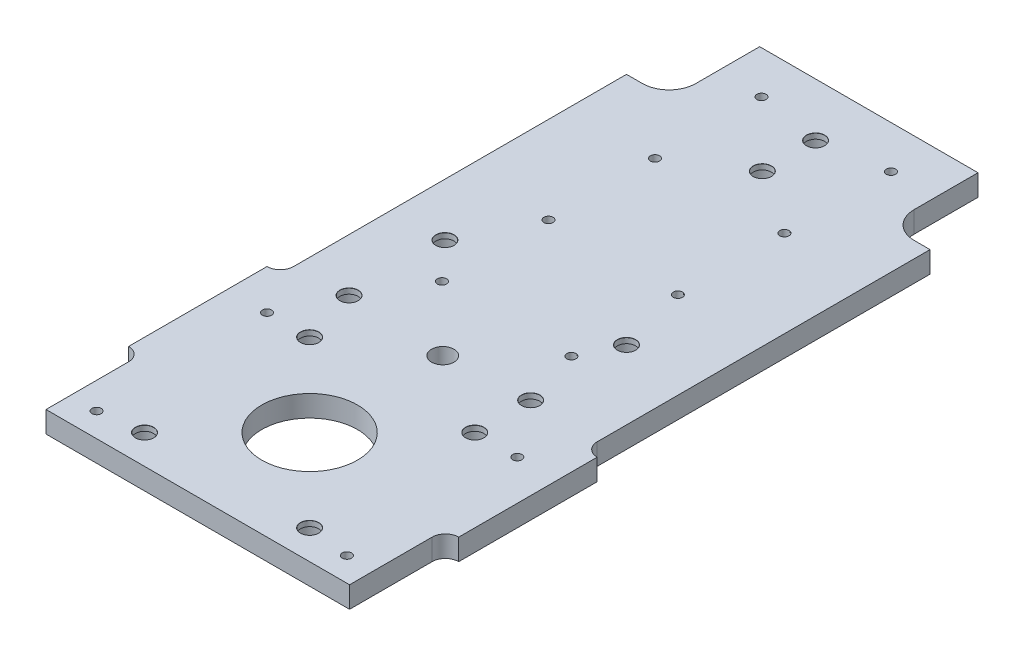
from build123d import *

# Parameters (mm, degrees)
PLATE_MAIN_SKETCH_R            = 0.86491532
PLATE_MAIN_SKETCH_R_2          = 8.982669203
PLATE_MAIN_SKETCH_R_3          = 2.111650326
EXTRUDE_PLATE_MAIN_DEPTH       = 4
CBORE_FOR_M3_SHCS1_AT_2_COUNT  = 2
CBORE_FOR_M3_SHCS1_AT_2_PITCH  = 31
CBORE_FOR_M3_SHCS1_AT_3_COUNT  = 2
CBORE_FOR_M3_SHCS1_AT_3_PITCH  = 43.840620434
CBORE_FOR_M3_SHCS1_AT_4_COUNT  = 2
CBORE_FOR_M3_SHCS1_AT_4_PITCH  = 31
CBORE_FOR_M3_SHCS1_AT_5_COUNT  = 2
CBORE_FOR_M3_SHCS1_AT_5_PITCH  = 41.615227408
CBORE_FOR_M3_SHCS1_AT_6_COUNT  = 2
CBORE_FOR_M3_SHCS1_AT_6_PITCH  = 51.800096525
CBORE_FOR_M3_SHCS1_AT_7_COUNT  = 2
CBORE_FOR_M3_SHCS1_AT_7_PITCH  = 67.091355628
CBORE_FOR_M3_SHCS1_AT_8_COUNT  = 2
CBORE_FOR_M3_SHCS1_AT_8_PITCH  = 59.580425915
CBORE_FOR_M3_SHCS1_AT_9_COUNT  = 2
CBORE_FOR_M3_SHCS1_AT_9_PITCH  = 101.688249075
CBORE_FOR_M3_SHCS1_AT_10_COUNT = 2
CBORE_FOR_M3_SHCS1_AT_10_PITCH = 111.581808553


with BuildPart() as part:
    # Plate Main Sketch → Extrude Plate Main (new body)
    with BuildSketch(Plane(origin=(-158.085545862, 0, 24.679095537), x_dir=(-1, 0, 0), z_dir=(0, 1, 0))):
        with BuildLine():
            Line((-178.585545862, -24.679095537), (-137.585545862, -24.679095537))
            Line((-137.585545862, -24.679095537), (-137.585545862, -12.679095537))
            ThreePointArc((-137.585545862, -12.679095537), (-136.121079768, -9.143561631), (-132.585545862, -7.679095537))
            Line((-132.585545862, -7.679095537), (-129.585545862, -7.679095537))
            Line((-129.585545862, -7.679095537), (-129.585545862, 54.820904463))
            ThreePointArc((-129.585545862, 54.820904463), (-128.853312815, 56.588671416), (-127.085545862, 57.320904463))
            Line((-127.085545862, 57.320904463), (-127.085545862, 83.320904463))
            ThreePointArc((-127.085545862, 83.320904463), (-128.853312815, 84.05313751), (-129.585545862, 85.820904463))
            Line((-129.585545862, 85.820904463), (-129.585545862, 101.320904463))
            Line((-129.585545862, 101.320904463), (-186.585545862, 101.320904463))
            Line((-186.585545862, 101.320904463), (-186.585545862, 85.820904463))
            ThreePointArc((-186.585545862, 85.820904463), (-187.317778909, 84.05313751), (-189.085545862, 83.320904463))
            Line((-189.085545862, 83.320904463), (-189.085545862, 57.320904463))
            ThreePointArc((-189.085545862, 57.320904463), (-187.317778909, 56.588671416), (-186.585545862, 54.820904463))
            Line((-186.585545862, 54.820904463), (-186.585545862, -7.679095537))
            Line((-186.585545862, -7.679095537), (-183.585545862, -7.679095537))
            ThreePointArc((-183.585545862, -7.679095537), (-180.050011956, -9.143561631), (-178.585545862, -12.679095537))
            Line((-178.585545862, -12.679095537), (-178.585545862, -24.679095537))
        make_face()
        with Locations(Location((-134.585545862, 96.820904463, 0), (0, 0, 90))):
            Circle(PLATE_MAIN_SKETCH_R, mode=Mode.SUBTRACT)
        with Locations(Location((-134.585545862, 64.820904463, 0), (0, 0, 90))):
            Circle(PLATE_MAIN_SKETCH_R, mode=Mode.SUBTRACT)
        with Locations(Location((-181.585545862, 64.820904463, 0), (0, 0, 90))):
            Circle(PLATE_MAIN_SKETCH_R, mode=Mode.SUBTRACT)
        with Locations(Location((-181.585545862, 96.820904463, 0), (0, 0, 90))):
            Circle(PLATE_MAIN_SKETCH_R, mode=Mode.SUBTRACT)
        with Locations(Location((-170.241643156, -16.679095537, 0), (0, 0, 90))):
            Circle(PLATE_MAIN_SKETCH_R, mode=Mode.SUBTRACT)
        with Locations(Location((-170.241643156, 3.320904463, 0), (0, 0, 90))):
            Circle(PLATE_MAIN_SKETCH_R, mode=Mode.SUBTRACT)
        with Locations(Location((-170.241643156, 23.320904463, 0), (0, 0, 90))):
            Circle(PLATE_MAIN_SKETCH_R, mode=Mode.SUBTRACT)
        with Locations(Location((-170.241643156, 43.320904463, 0), (0, 0, 90))):
            Circle(PLATE_MAIN_SKETCH_R, mode=Mode.SUBTRACT)
        with Locations(Location((-145.929448569, -16.679095537, 0), (0, 0, 270))):
            Circle(PLATE_MAIN_SKETCH_R, mode=Mode.SUBTRACT)
        with Locations(Location((-145.929448569, 3.320904463, 0), (0, 0, 270))):
            Circle(PLATE_MAIN_SKETCH_R, mode=Mode.SUBTRACT)
        with Locations(Location((-145.929448569, 23.320904463, 0), (0, 0, 270))):
            Circle(PLATE_MAIN_SKETCH_R, mode=Mode.SUBTRACT)
        with Locations(Location((-145.929448569, 43.320904463, 0), (0, 0, 270))):
            Circle(PLATE_MAIN_SKETCH_R, mode=Mode.SUBTRACT)
        with Locations(Location((-158.085545862, 80.320904463, 0), (0, 0, 90))):
            Circle(PLATE_MAIN_SKETCH_R_2, mode=Mode.SUBTRACT)
        with Locations(Location((-158.085545862, 55.320904463, 0), (0, 0, 90))):
            Circle(PLATE_MAIN_SKETCH_R_3, mode=Mode.SUBTRACT)
    extrude(amount=EXTRUDE_PLATE_MAIN_DEPTH)

    # Sketch5 → CBORE for M3 SHCS1 (revolve, cut)
    with BuildSketch(Plane(origin=(-15.5, 0, 120.5), x_dir=(0, 0, -1), z_dir=(1, 0, 0))):
        Polygon((0, 0), (0, 4), (1.725, 4), (1.7, 3.975), (1.7, 3), (3, 3), (3, 0), align=None)
    cbore_for_m3_shcs1 = revolve(axis=Axis((-15.5, -6.35, 120.5), (0, 1, 0)), mode=Mode.SUBTRACT)

    # CBORE for M3 SHCS1 at 2: CBORE for M3 SHCS1 ×2
    with Locations(*[(i * CBORE_FOR_M3_SHCS1_AT_2_PITCH, 0, 0) for i in range(1, CBORE_FOR_M3_SHCS1_AT_2_COUNT)]):
        add(cbore_for_m3_shcs1, mode=Mode.SUBTRACT)

    # CBORE for M3 SHCS1 at 3: CBORE for M3 SHCS1 ×2
    with Locations(*[Vector(0.7071067811865482, 0, -0.7071067811865469) * (i * CBORE_FOR_M3_SHCS1_AT_3_PITCH) for i in range(1, CBORE_FOR_M3_SHCS1_AT_3_COUNT)]):
        add(cbore_for_m3_shcs1, mode=Mode.SUBTRACT)

    # CBORE for M3 SHCS1 at 4: CBORE for M3 SHCS1 ×2
    with Locations(*[(0, 0, -i * CBORE_FOR_M3_SHCS1_AT_4_PITCH) for i in range(1, CBORE_FOR_M3_SHCS1_AT_4_COUNT)]):
        add(cbore_for_m3_shcs1, mode=Mode.SUBTRACT)

    # CBORE for M3 SHCS1 at 5: CBORE for M3 SHCS1 ×2
    with Locations(*[Vector(-0.07436454462395926, 0, -0.9972311239140459) * (i * CBORE_FOR_M3_SHCS1_AT_5_PITCH) for i in range(1, CBORE_FOR_M3_SHCS1_AT_5_COUNT)]):
        add(cbore_for_m3_shcs1, mode=Mode.SUBTRACT)

    # CBORE for M3 SHCS1 at 6: CBORE for M3 SHCS1 ×2
    with Locations(*[Vector(0.5984544832852718, 0, -0.801156808268992) * (i * CBORE_FOR_M3_SHCS1_AT_6_PITCH) for i in range(1, CBORE_FOR_M3_SHCS1_AT_6_COUNT)]):
        add(cbore_for_m3_shcs1, mode=Mode.SUBTRACT)

    # CBORE for M3 SHCS1 at 7: CBORE for M3 SHCS1 ×2
    with Locations(*[Vector(0.4620565452857235, 0, -0.8868504659516295) * (i * CBORE_FOR_M3_SHCS1_AT_7_PITCH) for i in range(1, CBORE_FOR_M3_SHCS1_AT_7_COUNT)]):
        add(cbore_for_m3_shcs1, mode=Mode.SUBTRACT)

    # CBORE for M3 SHCS1 at 8: CBORE for M3 SHCS1 ×2
    with Locations(*[Vector(-0.051941512469712944, 0, -0.9986501285647335) * (i * CBORE_FOR_M3_SHCS1_AT_8_PITCH) for i in range(1, CBORE_FOR_M3_SHCS1_AT_8_COUNT)]):
        add(cbore_for_m3_shcs1, mode=Mode.SUBTRACT)

    # CBORE for M3 SHCS1 at 9: CBORE for M3 SHCS1 ×2
    with Locations(*[Vector(0.15242665834989946, 0, -0.9883147847848291) * (i * CBORE_FOR_M3_SHCS1_AT_9_PITCH) for i in range(1, CBORE_FOR_M3_SHCS1_AT_9_COUNT)]):
        add(cbore_for_m3_shcs1, mode=Mode.SUBTRACT)

    # CBORE for M3 SHCS1 at 10: CBORE for M3 SHCS1 ×2
    with Locations(*[Vector(0.13891153227375588, 0, -0.9903047945967732) * (i * CBORE_FOR_M3_SHCS1_AT_10_PITCH) for i in range(1, CBORE_FOR_M3_SHCS1_AT_10_COUNT)]):
        add(cbore_for_m3_shcs1, mode=Mode.SUBTRACT)


solid = part.part
